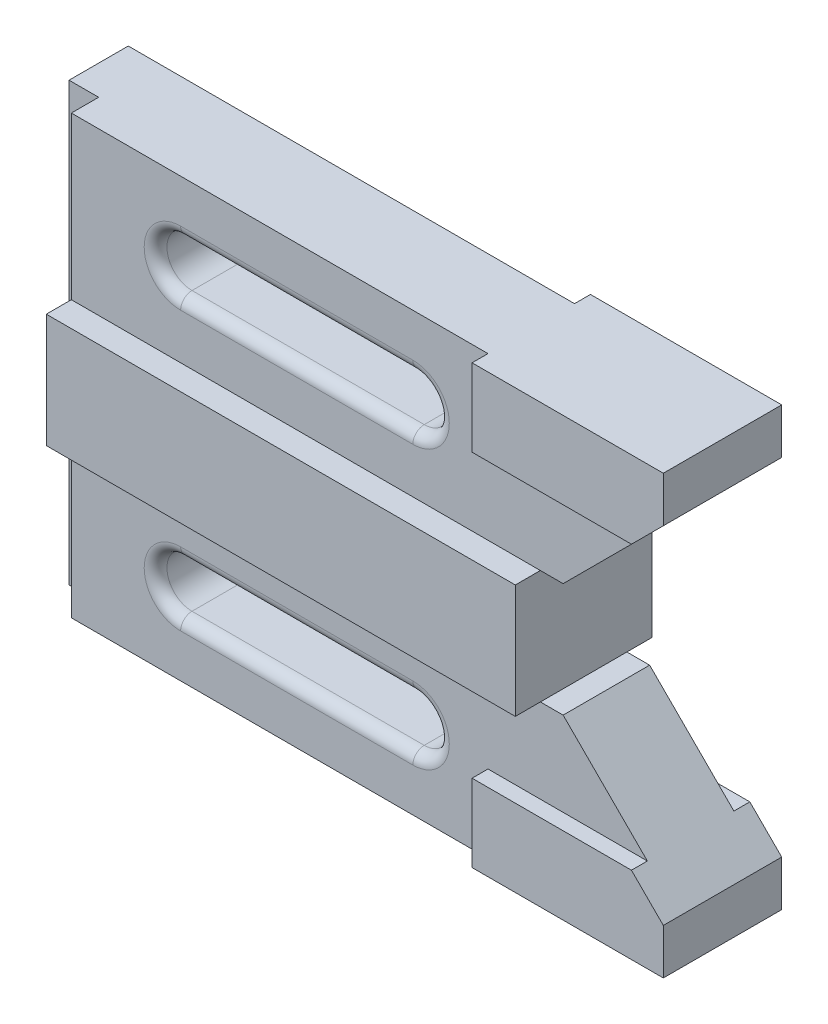
from build123d import *

# Parameters (mm, degrees)
SKETCH1_W           = 109.5
SKETCH1_H           = 12.5
BOSS_EXTRUDE1_DEPTH = 15
BOSS_EXTRUDE2_DEPTH = 9.5
BOSS_EXTRUDE3_DEPTH = 13
SKETCH2_W           = 6.5
SKETCH2_H           = 11.5
CUT_EXTRUDE1_DEPTH  = 149.758193052
FILLET1_R           = 2.5


with BuildPart() as part:
    # Sketch1 → Boss-Extrude1 (new, symmetric)
    with BuildSketch(Plane.XY):
        with Locations((54.75, 6.25)):
            Rectangle(SKETCH1_W, SKETCH1_H)
    extrude(amount=BOSS_EXTRUDE1_DEPTH, both=True)

    # Sketch1<3> → Boss-Extrude2 (add, symmetric)
    with BuildSketch(Plane.XY):
        Polygon((0, 12.5), (109.5, 12.5), (114.5, 12.5), (133, 31), (98, 31), (98, 48), (0, 48), align=None)
        with BuildLine():
            ThreePointArc((30.5, 25), (25, 30.5), (30.5, 36))
            Line((30.5, 36), (81.5, 36))
            ThreePointArc((81.5, 36), (87, 30.5), (81.5, 25))
            Line((81.5, 25), (30.5, 25))
        make_face(mode=Mode.SUBTRACT)
    extrude(amount=BOSS_EXTRUDE2_DEPTH, both=True)

    # Sketch1<4> → Boss-Extrude3 (add, symmetric)
    with BuildSketch(Plane.XY):
        Polygon((98, 31), (133, 31), (140, 38), (140, 48), (98, 48), align=None)
    extrude(amount=BOSS_EXTRUDE3_DEPTH, both=True)

    # Sketch2 → Cut-Extrude1 (cut, through all)
    with BuildSketch(Plane(origin=(0, 48, 0), x_dir=(1, 0, 0), z_dir=(0, 1, 0))):
        with Locations((3.25, -9.25)):
            Rectangle(SKETCH2_W, SKETCH2_H)
    extrude(amount=-CUT_EXTRUDE1_DEPTH, mode=Mode.SUBTRACT)

    # Fillet1
    fillet1_edges = [part.edges().sort_by_distance(p)[0] for p in [
        (25, 30.5, -9.5),
        (56, 25, -9.5),
        (87, 30.5, -9.5),
        (56, 36, -9.5),
        (87, 30.5, 9.5),
        (56, 25, 9.5),
        (25, 30.5, 9.5),
        (56, 36, 9.5),
    ]]
    fillet(fillet1_edges, radius=FILLET1_R)

    # Mirror2: part across plane


with BuildPart() as part_1:
    add(part.part)
    add(part.part.mirror(Plane(origin=(0, 0, 15), x_dir=(0, 0, 1), z_dir=(0, -1, 0))))


solid = part_1.part
